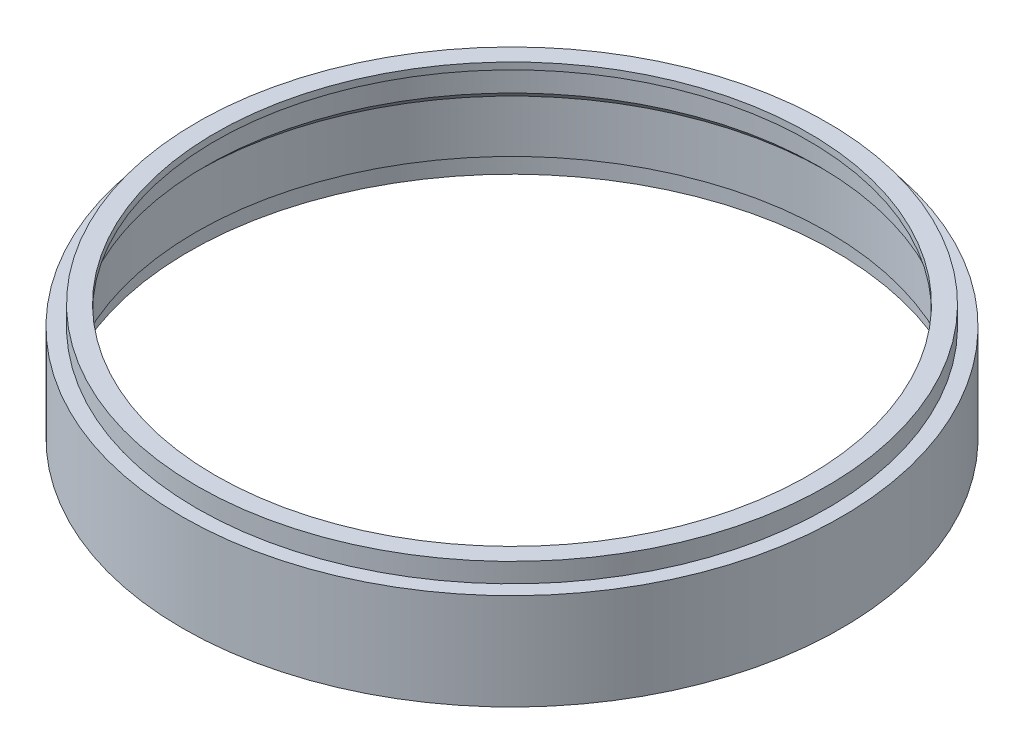
from build123d import *


with BuildPart() as part:
    # Sketch1 → Revolve1 (revolve)
    with BuildSketch(Plane.XY):
        Polygon((-48.35, 0), (-48.35, 14.15), (-46.219999369, 14.15), (-46.219999369, 17), (-43.519999369, 17), (-43.519999369, 16), (-45.019999369, 16), (-45.019999369, 12), (-46.35, 10.669999369), (-46.35, 3), (-47.4, 3), (-47.4, 0), align=None)
    revolve(axis=Axis((0, 0, 0), (0, -1, 0)))


solid = part.part
